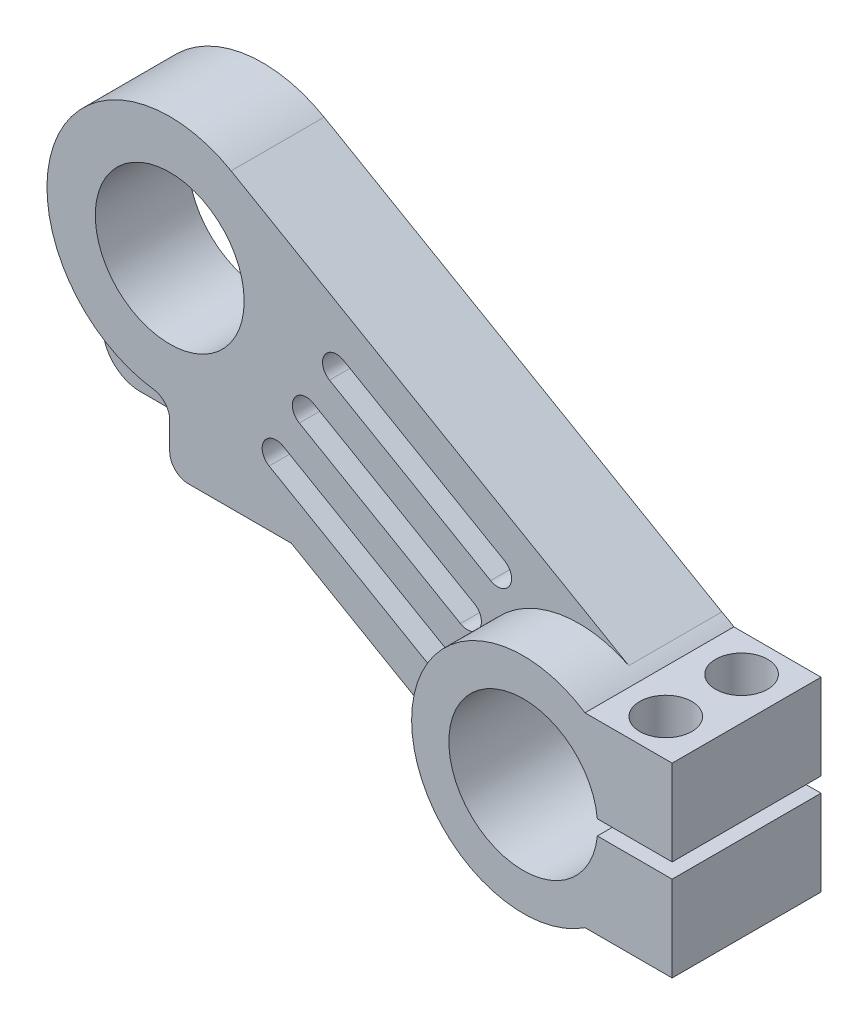
from build123d import *

# Parameters (mm, degrees)
CROQUIS1_R                                           = 40
SALIENTE_EXTRUIR2_DEPTH                              = 50
SALIENTE_EXTRUIR3_DEPTH                              = 80
SALIENTE_EXTRUIR4_DEPTH                              = 20
REFRENTADO_PARA_TORNILLO_CON_CABEZA_TRON_D           = 16
REFRENTADO_PARA_TORNILLO_CON_CABEZA_TRON_CBORE_D     = 28
REFRENTADO_PARA_TORNILLO_CON_CABEZA_TRON_CBORE_DEPTH = 20


with BuildPart() as part:
    # Croquis1 → Saliente-Extruir2 (new body)
    with BuildSketch(Plane.XY):
        with BuildLine():
            ThreePointArc((-187.0195, 177.123901659), (-252.9805, 177.123901659), (-285.961, 120))
            ThreePointArc((-285.961, 120), (-269.616671449, 76.536918708), (-228.683534972, 54.613076679))
            ThreePointArc((-228.683534972, 54.613076679), (-222.477877617, 51.289318393), (-220, 44.700109422))
            Line((-220, 44.700109422), (-220, 30))
            ThreePointArc((-220, 30), (-217.071067812, 22.928932188), (-210, 20))
            Line((-210, 20), (-154.641016151, 20))
            Line((-154.641016151, 20), (-30, -51.961524227))
            ThreePointArc((-30, -51.961524227), (-52.868956993, 28.370290561), (26.713161338, 53.725292101))
            Line((26.713161338, 53.725292101), (-187.0195, 177.123901659))
        make_face()
        with BuildLine():
            ThreePointArc((-72.471012114, 12.973644893), (-69.725821585, 2.728454364), (-79.971012114, -0.016736164))
            Line((-79.971012114, -0.016736164), (-166.573552492, 49.983263836))
            ThreePointArc((-166.573552492, 49.983263836), (-169.31874302, 60.228454364), (-159.073552492, 62.973644893))
            Line((-159.073552492, 62.973644893), (-72.471012114, 12.973644893))
        make_face(mode=Mode.SUBTRACT)
        with BuildLine():
            ThreePointArc((-56.25, 41.069262024), (-53.504809472, 30.824071495), (-63.75, 28.078880967))
            Line((-63.75, 28.078880967), (-150.352540378, 78.078880967))
            ThreePointArc((-150.352540378, 78.078880967), (-153.097730907, 88.324071495), (-142.852540378, 91.069262024))
            Line((-142.852540378, 91.069262024), (-56.25, 41.069262024))
        make_face(mode=Mode.SUBTRACT)
        with Locations((-220, 120)):
            Circle(CROQUIS1_R, mode=Mode.SUBTRACT)
        with BuildLine():
            ThreePointArc((-40.028987886, 69.164879154), (-37.283797358, 58.919688626), (-47.528987886, 56.174498098))
            Line((-47.528987886, 56.174498098), (-134.131528265, 106.174498098))
            ThreePointArc((-134.131528265, 106.174498098), (-136.876718793, 116.419688626), (-126.631528265, 119.164879154))
            Line((-126.631528265, 119.164879154), (-40.028987886, 69.164879154))
        make_face(mode=Mode.SUBTRACT)
    extrude(amount=SALIENTE_EXTRUIR2_DEPTH)

    # Croquis1<4> → Saliente-Extruir3 (add)
    with BuildSketch(Plane.XY):
        with BuildLine():
            ThreePointArc((33.166247904, 50), (29.997589288, 51.962915978), (26.713161338, 53.725292101))
            ThreePointArc((26.713161338, 53.725292101), (-52.868956993, 28.370290561), (-30, -51.961524227))
            ThreePointArc((-30, -51.961524227), (1.862303888, -59.971091571), (33.166247904, -50))
            Line((33.166247904, -50), (80, -50))
            Line((80, -50), (80, -4))
            Line((80, -4), (39.799497484, -4))
            ThreePointArc((39.799497484, -4), (-40, 0), (39.799497484, 4))
            Line((39.799497484, 4), (80, 4))
            Line((80, 4), (80, 50))
            Line((80, 50), (33.166247904, 50))
        make_face()
    extrude(amount=SALIENTE_EXTRUIR3_DEPTH)

    # Croquis1<5> → Saliente-Extruir4 (add)
    with BuildSketch(Plane.XY):
        with BuildLine():
            ThreePointArc((-228.683534972, 54.613076679), (-269.616671449, 76.536918708), (-285.961, 120))
            Line((-285.961, 120), (-285.961, 40))
            ThreePointArc((-285.961, 40), (-280.103135624, 25.857864376), (-265.961, 20))
            Line((-265.961, 20), (-210, 20))
            ThreePointArc((-210, 20), (-217.071067812, 22.928932188), (-220, 30))
            Line((-220, 30), (-220, 44.700109422))
            ThreePointArc((-220, 44.700109422), (-222.477877617, 51.289318393), (-228.683534972, 54.613076679))
        make_face()
    extrude(amount=SALIENTE_EXTRUIR4_DEPTH)

    # Refrentado para tornillo con cabeza troncocónica de M52 (through all)
    with Locations(Plane(origin=(56.583, 50, 60), x_dir=(0, 0, 1), z_dir=(0, 1, 0))):
        with Locations((0, 0), (-40, 0.726384558)):
            CounterBoreHole(REFRENTADO_PARA_TORNILLO_CON_CABEZA_TRON_D / 2, REFRENTADO_PARA_TORNILLO_CON_CABEZA_TRON_CBORE_D / 2, REFRENTADO_PARA_TORNILLO_CON_CABEZA_TRON_CBORE_DEPTH)


solid = part.part
